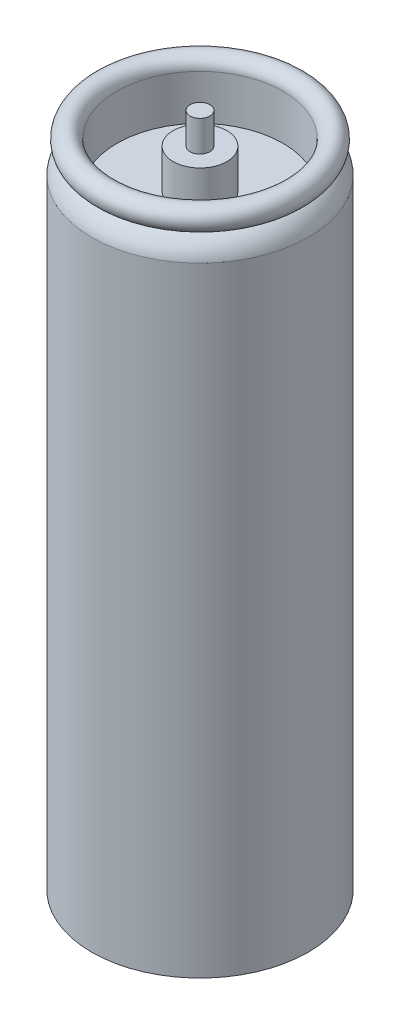
from build123d import *


with BuildPart() as part:
    # Sketch1 → Revolve1 (revolve)
    with BuildSketch(Plane.XY, mode=Mode.PRIVATE) as revolve1_sk:
        with BuildLine():
            Line((-15.5, 0), (-17.5, 0))
            Line((-17.5, 0), (-17.5, 100))
            ThreePointArc((-17.5, 100), (-16.53803894, 102.011461655), (-14.675685538, 103.237425306))
            ThreePointArc((-14.675685538, 103.237425306), (-16.718615549, 106.063714958), (-13.402842077, 104.983380513))
            Line((-13.402842077, 104.983380513), (-13.402842077, 97.692354136))
            Line((-13.402842077, 97.692354136), (-4.333255578, 97.692354136))
            Line((-4.333255578, 97.692354136), (-4.333255578, 103.999749208))
            Line((-4.333255578, 103.999749208), (-1.5875, 103.999749208))
            Line((-1.5875, 103.999749208), (-1.5875, 108.999749208))
            Line((-1.5875, 108.999749208), (0, 108.999749208))
            Line((0, 108.999749208), (0, 2.753698387))
            ThreePointArc((0, 2.753698387), (-7.871353994, 2.059925785), (-15.5, 0))
        make_face()
    revolve(revolve1_sk.sketch.rotate(Axis((0, -1000, 0), (0, 1, 0)), 270), axis=Axis((0, -1000, 0), (0, 1, 0)))


solid = part.part
